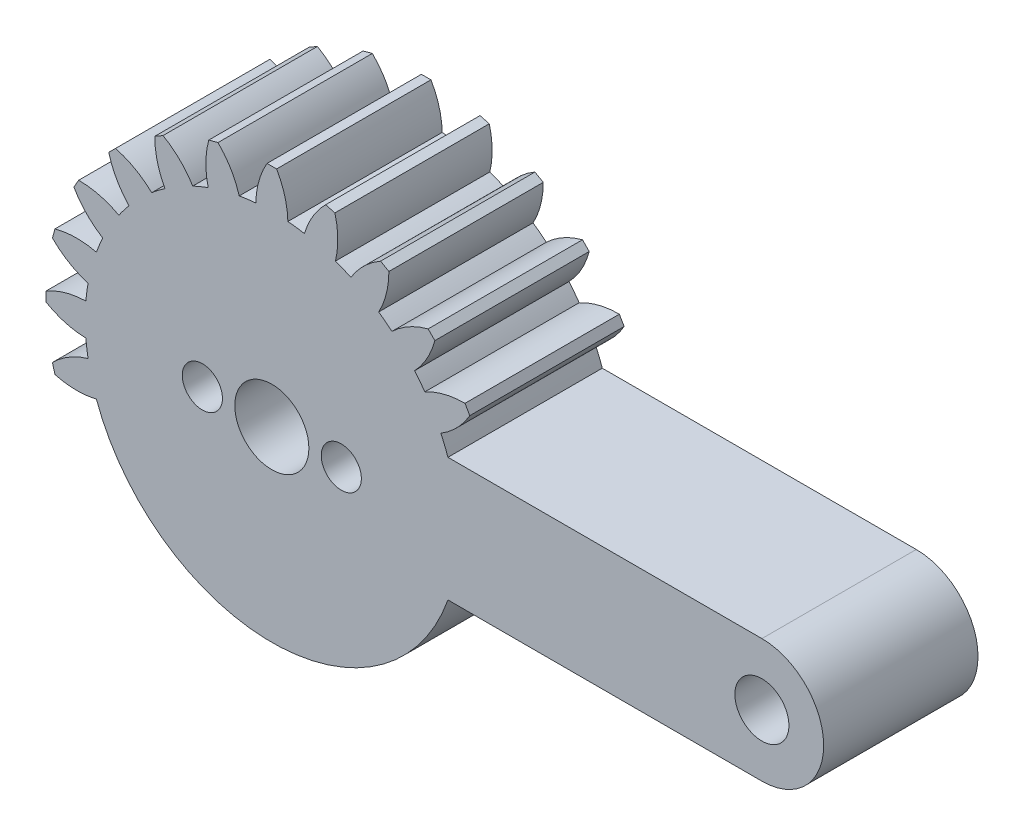
from build123d import *

# Parameters (mm, degrees)
SKETCH1_R           = 1.75
BOSS_EXTRUDE1_DEPTH = 10
SKETCH2_R           = 1.3
SKETCH2_R_2         = 2.4
CUT_EXTRUDE2_DEPTH  = 40.901120285


with BuildPart() as part:
    # Sketch1 → Boss-Extrude1 (new body)
    with BuildSketch(Plane.XY):
        with BuildLine():
            Line((0.31, 14.63), (-0.31, 14.63))
            ThreePointArc((-0.31, 14.63), (-0.838273314, 13.383704325), (-1.04, 12.04518576))
            ThreePointArc((-1.04, 12.04518576), (-1.578061664, 11.986568374), (-2.112960617, 11.903927815))
            ThreePointArc((-2.112960617, 11.903927815), (-2.65424773, 13.144626757), (-3.487085624, 14.211728743))
            Line((-3.487085624, 14.211728743), (-4.085959636, 14.051260935))
            ThreePointArc((-4.085959636, 14.051260935), (-4.273667417, 12.71070456), (-4.122086336, 11.365584201))
            ThreePointArc((-4.122086336, 11.365584201), (-4.626642697, 11.169703548), (-5.12192646, 10.951436862))
            ThreePointArc((-5.12192646, 10.951436862), (-5.965886177, 12.009764599), (-7.046532125, 12.824951657))
            Line((-7.046532125, 12.824951657), (-7.583467875, 12.514951657))
            ThreePointArc((-7.583467875, 12.514951657), (-7.417818147, 11.171491285), (-6.9232593, 9.911436862))
            ThreePointArc((-6.9232593, 9.911436862), (-7.359925677, 9.591641884), (-7.781841479, 9.252623584))
            ThreePointArc((-7.781841479, 9.252623584), (-8.870959341, 10.05645683), (-10.125769107, 10.564175311))
            Line((-10.125769107, 10.564175311), (-10.564175311, 10.125769107))
            ThreePointArc((-10.564175311, 10.125769107), (-10.05645683, 8.870959341), (-9.252623584, 7.781841479))
            ThreePointArc((-9.252623584, 7.781841479), (-9.591641884, 7.359925677), (-9.911436862, 6.9232593))
            ThreePointArc((-9.911436862, 6.9232593), (-11.171491285, 7.417818147), (-12.514951657, 7.583467875))
            Line((-12.514951657, 7.583467875), (-12.824951657, 7.046532125))
            ThreePointArc((-12.824951657, 7.046532125), (-12.009764599, 5.965886177), (-10.951436862, 5.12192646))
            ThreePointArc((-10.951436862, 5.12192646), (-11.169703548, 4.626642697), (-11.365584201, 4.122086336))
            ThreePointArc((-11.365584201, 4.122086336), (-12.71070456, 4.273667417), (-14.051260935, 4.085959636))
            Line((-14.051260935, 4.085959636), (-14.211728743, 3.487085624))
            ThreePointArc((-14.211728743, 3.487085624), (-13.144626757, 2.65424773), (-11.903927815, 2.112960617))
            ThreePointArc((-11.903927815, 2.112960617), (-11.986568374, 1.578061664), (-12.04518576, 1.04))
            ThreePointArc((-12.04518576, 1.04), (-13.383704325, 0.838273314), (-14.63, 0.31))
            Line((-14.63, 0.31), (-14.63, -0.31))
            ThreePointArc((-14.63, -0.31), (-13.383704325, -0.838273314), (-12.04518576, -1.04))
            ThreePointArc((-12.04518576, -1.04), (-11.986568374, -1.578061664), (-11.903927815, -2.112960617))
            ThreePointArc((-11.903927815, -2.112960617), (-13.144626757, -2.65424773), (-14.211728743, -3.487085624))
            Line((-14.211728743, -3.487085624), (-14.051260935, -4.085959636))
            ThreePointArc((-14.051260935, -4.085959636), (-12.71070456, -4.273667417), (-11.365584201, -4.122086336))
            ThreePointArc((-11.365584201, -4.122086336), (0.064808849, -12.089826294), (11.409123542, -4))
            Line((11.409123542, -4), (31.75, -4))
            ThreePointArc((31.75, -4), (35.75, 0), (31.75, 4))
            Line((31.75, 4), (11.409123542, 4))
            ThreePointArc((11.409123542, 4), (11.194344337, 4.566700654), (10.951436862, 5.12192646))
            ThreePointArc((10.951436862, 5.12192646), (12.009764599, 5.965886177), (12.824951657, 7.046532125))
            Line((12.824951657, 7.046532125), (12.514951657, 7.583467875))
            ThreePointArc((12.514951657, 7.583467875), (11.171491285, 7.417818147), (9.911436862, 6.9232593))
            ThreePointArc((9.911436862, 6.9232593), (9.591641884, 7.359925677), (9.252623584, 7.781841479))
            ThreePointArc((9.252623584, 7.781841479), (10.05645683, 8.870959341), (10.564175311, 10.125769107))
            Line((10.564175311, 10.125769107), (10.125769107, 10.564175311))
            ThreePointArc((10.125769107, 10.564175311), (8.870959341, 10.05645683), (7.781841479, 9.252623584))
            ThreePointArc((7.781841479, 9.252623584), (7.359925677, 9.591641884), (6.9232593, 9.911436862))
            ThreePointArc((6.9232593, 9.911436862), (7.417818147, 11.171491285), (7.583467875, 12.514951657))
            Line((7.583467875, 12.514951657), (7.046532125, 12.824951657))
            ThreePointArc((7.046532125, 12.824951657), (5.965886177, 12.009764599), (5.12192646, 10.951436862))
            ThreePointArc((5.12192646, 10.951436862), (4.626642697, 11.169703548), (4.122086336, 11.365584201))
            ThreePointArc((4.122086336, 11.365584201), (4.273667417, 12.71070456), (4.085959636, 14.051260935))
            Line((4.085959636, 14.051260935), (3.487085624, 14.211728743))
            ThreePointArc((3.487085624, 14.211728743), (2.65424773, 13.144626757), (2.112960617, 11.903927815))
            ThreePointArc((2.112960617, 11.903927815), (1.578061664, 11.986568374), (1.04, 12.04518576))
            ThreePointArc((1.04, 12.04518576), (0.838273314, 13.383704325), (0.31, 14.63))
        make_face()
        Circle(SKETCH1_R, mode=Mode.SUBTRACT)
        with Locations((31.75, 0)):
            Circle(SKETCH1_R, mode=Mode.SUBTRACT)
    extrude(amount=BOSS_EXTRUDE1_DEPTH)

    # Sketch2 → Cut-Extrude2 (cut, through all)
    with BuildSketch(Plane.XY.offset(10)):
        with Locations((-4.5, 0)):
            Circle(SKETCH2_R)
        with Locations((4.5, 0)):
            Circle(SKETCH2_R)
        Circle(SKETCH2_R_2)
    extrude(amount=-CUT_EXTRUDE2_DEPTH, mode=Mode.SUBTRACT)


solid = part.part
